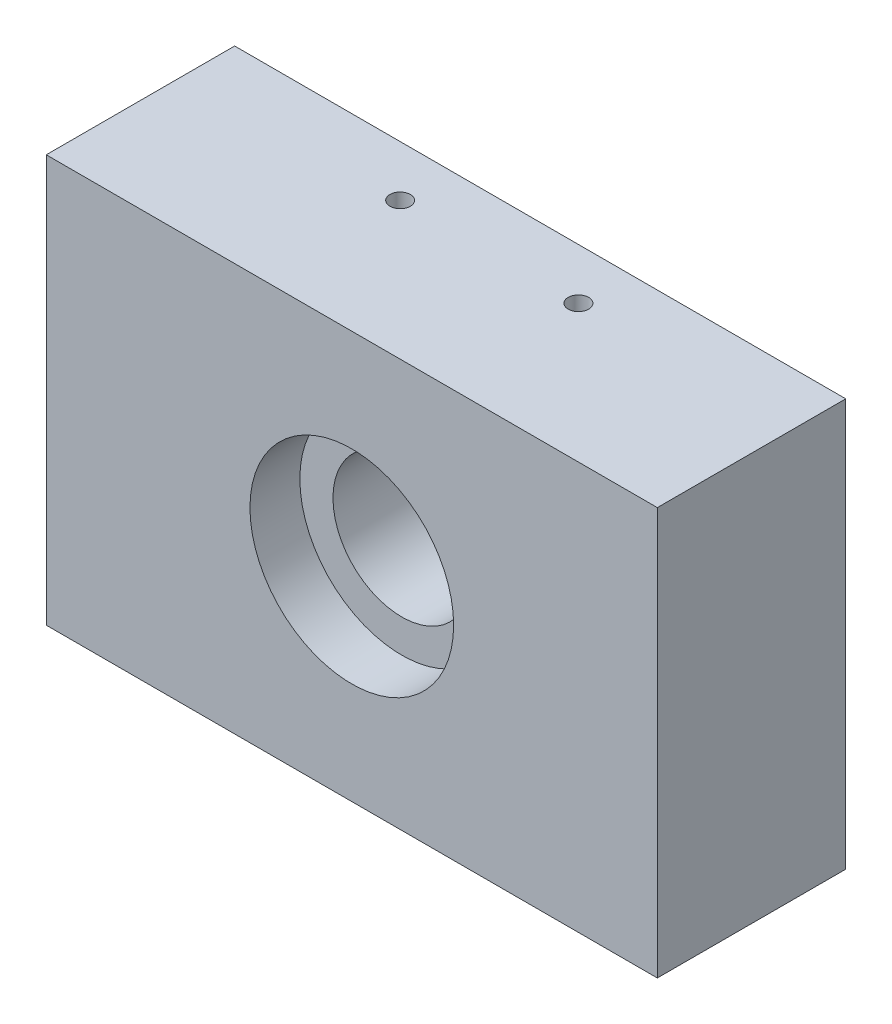
from build123d import *

# Parameters (mm, degrees)
SKETCH1_W                       = 152.4
SKETCH1_H                       = 101.6
BOSS_EXTRUDE1_DEPTH             = 46.99
SKETCH2_R                       = 17.145
CUT_EXTRUDE1_DEPTH              = 190.093574983
SKETCH2_2_R                     = 25.4
SKETCH2_2_R_2                   = 17.145
CUT_EXTRUDE3_DEPTH              = 12.446
TAP_DRILL_FOR_1_2_13_TAP1_D     = 10.71626
TAP_DRILL_FOR_1_2_13_TAP1_DEPTH = 19.05
TAP_DRILL_FOR_1_2_13_TAP1_TIP   = 3.219489309
TAP_DRILL_FOR_1_4_20_TAP1_D     = 5.1054
TAP_DRILL_FOR_1_4_20_TAP1_DEPTH = 13.706183098
TAP_DRILL_FOR_1_4_20_TAP1_TIP   = 1.533816902


with BuildPart() as part:
    # Sketch1 → Boss-Extrude1 (new body)
    with BuildSketch(Plane.XY):
        with Locations((76.2, 50.8)):
            Rectangle(SKETCH1_W, SKETCH1_H)
    extrude(amount=BOSS_EXTRUDE1_DEPTH)

    # Sketch2 → Cut-Extrude1 (cut, through all)
    with BuildSketch(Plane(origin=(0, 0, 0), x_dir=(-1, 0, 0), z_dir=(0, 0, -1))):
        with Locations((-76.2, 50.8)):
            Circle(SKETCH2_R)
    extrude(amount=-CUT_EXTRUDE1_DEPTH, mode=Mode.SUBTRACT)

    # Sketch2<2> → Cut-Extrude3 (cut)
    with BuildSketch(Plane(origin=(0, 0, 0), x_dir=(-1, 0, 0), z_dir=(0, 0, -1))):
        with Locations((-76.2, 50.8)):
            Circle(SKETCH2_2_R)
        with Locations((-76.2, 50.8)):
            Circle(SKETCH2_2_R_2, mode=Mode.SUBTRACT)
    cut_extrude3 = extrude(amount=-CUT_EXTRUDE3_DEPTH, mode=Mode.SUBTRACT)

    # Mirror2: Cut-Extrude3 across plane
    add(cut_extrude3.mirror(Plane(origin=(0, 0, 23.495), x_dir=(1, 0, 0), z_dir=(0, 0, -1))), mode=Mode.SUBTRACT)

    # Tap Drill for 1/2-13 Tap1
    with Locations(Plane(origin=(0, 0, 0), x_dir=(-1, 0, 0), z_dir=(0, -1, 0))):
        with Locations((-68.051669078, -23.495), (-29.951669078, -23.495)):
            Hole(TAP_DRILL_FOR_1_2_13_TAP1_D / 2, depth=TAP_DRILL_FOR_1_2_13_TAP1_DEPTH)
            with Locations((0, 0, -(TAP_DRILL_FOR_1_2_13_TAP1_DEPTH + TAP_DRILL_FOR_1_2_13_TAP1_TIP / 2))):  # 118° drill point
                Cone(0, TAP_DRILL_FOR_1_2_13_TAP1_D / 2, TAP_DRILL_FOR_1_2_13_TAP1_TIP, mode=Mode.SUBTRACT)

    # Tap Drill for 1/4-20 Tap1
    with Locations(Plane(origin=(50.8, 101.6, 0), x_dir=(0, 0, -1), z_dir=(0, 1, 0))):
        with Locations((-12.7, -47.625), (-12.7, -3.175)):
            Hole(TAP_DRILL_FOR_1_4_20_TAP1_D / 2, depth=TAP_DRILL_FOR_1_4_20_TAP1_DEPTH)
            with Locations((0, 0, -(TAP_DRILL_FOR_1_4_20_TAP1_DEPTH + TAP_DRILL_FOR_1_4_20_TAP1_TIP / 2))):  # 118° drill point
                Cone(0, TAP_DRILL_FOR_1_4_20_TAP1_D / 2, TAP_DRILL_FOR_1_4_20_TAP1_TIP, mode=Mode.SUBTRACT)


solid = part.part
